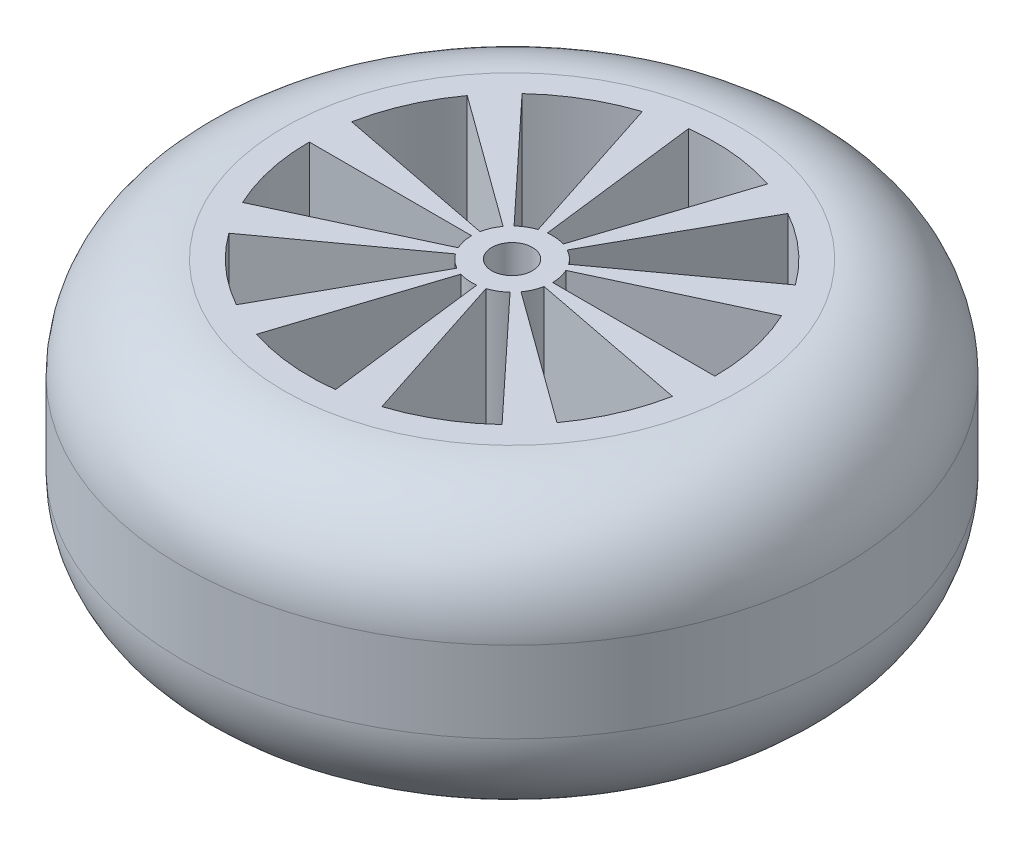
from build123d import *

# Parameters (mm, degrees)
SKETCH1_R           = 32.5
SKETCH1_R_2         = 2
BOSS_EXTRUDE1_DEPTH = 28
FILLET1_R           = 10
CUT_EXTRUDE2_DEPTH  = 28


with BuildPart() as part:
    # Sketch1 → Boss-Extrude1 (new body)
    with BuildSketch(Plane(origin=(0, 0, 0), x_dir=(1, 0, 0), z_dir=(0, 1, 0))):
        with Locations(Location((0, 0, 0), (0, 0, 270))):
            Circle(SKETCH1_R)
        with Locations(Location((0, 0, 0), (0, 0, 270))):
            Circle(SKETCH1_R_2, mode=Mode.SUBTRACT)
    extrude(amount=BOSS_EXTRUDE1_DEPTH)

    # Fillet1
    fillet1_edges = [part.edges().sort_by_distance(p)[0] for p in [
        (0, 0, -32.5),
        (0, 28, -32.5),
    ]]
    fillet(fillet1_edges, radius=FILLET1_R)

    # Sketch2 → Cut-Extrude2 (cut)
    with BuildSketch(Plane(origin=(0, 28, 0), x_dir=(1, 0, 0), z_dir=(0, 1, 0))):
        with BuildLine():
            ThreePointArc((-2.72799344, 2.925414806), (-2.030153452, 3.446516642), (-1.236067977, 3.804226065))
            Line((-1.236067977, 3.804226065), (-6.180339887, 19.021130326))
            ThreePointArc((-6.180339887, 19.021130326), (-10.150767259, 17.232583209), (-13.639967201, 14.627074032))
            Line((-13.639967201, 14.627074032), (-2.72799344, 2.925414806))
        make_face()
        with BuildLine():
            ThreePointArc((2.72799344, -2.925414806), (2.030153452, -3.446516642), (1.236067977, -3.804226065))
            Line((1.236067977, -3.804226065), (6.180339887, -19.021130326))
            ThreePointArc((6.180339887, -19.021130326), (10.150767259, -17.232583209), (13.639967201, -14.627074032))
            Line((13.639967201, -14.627074032), (2.72799344, -2.925414806))
        make_face()
        with BuildLine():
            ThreePointArc((0.487477374, -3.970184607), (-0.38338301, -3.981584793), (-1.236067977, -3.804226065))
            Line((-1.236067977, -3.804226065), (-6.180339887, -19.021130326))
            ThreePointArc((-6.180339887, -19.021130326), (-1.91691505, -19.907923967), (2.437386868, -19.850923033))
            Line((2.437386868, -19.850923033), (0.487477374, -3.970184607))
        make_face()
        with BuildLine():
            ThreePointArc((-0.487477374, 3.970184607), (0.38338301, 3.981584793), (1.236067977, 3.804226065))
            Line((1.236067977, 3.804226065), (6.180339887, 19.021130326))
            ThreePointArc((6.180339887, 19.021130326), (1.91691505, 19.907923967), (-2.437386868, 19.850923033))
            Line((-2.437386868, 19.850923033), (-0.487477374, 3.970184607))
        make_face()
        with BuildLine():
            ThreePointArc((1.939238481, 3.498478829), (2.650480193, 2.995822883), (3.236067977, 2.351141009))
            Line((3.236067977, 2.351141009), (16.180339887, 11.755705046))
            ThreePointArc((16.180339887, 11.755705046), (13.252400964, 14.979114416), (9.696192405, 17.492394143))
            Line((9.696192405, 17.492394143), (1.939238481, 3.498478829))
        make_face()
        with BuildLine():
            ThreePointArc((-1.939238481, -3.498478829), (-2.650480193, -2.995822883), (-3.236067977, -2.351141009))
            Line((-3.236067977, -2.351141009), (-16.180339887, -11.755705046))
            ThreePointArc((-16.180339887, -11.755705046), (-13.252400964, -14.979114416), (-9.696192405, -17.492394143))
            Line((-9.696192405, -17.492394143), (-1.939238481, -3.498478829))
        make_face()
        with BuildLine():
            ThreePointArc((3.625231148, 1.690473047), (3.905184028, 0.865758456), (4, 0))
            Line((4, 0), (20, 0))
            ThreePointArc((20, 0), (19.525920142, 4.328792279), (18.126155741, 8.452365235))
            Line((18.126155741, 8.452365235), (3.625231148, 1.690473047))
        make_face()
        with BuildLine():
            ThreePointArc((-3.625231148, -1.690473047), (-3.905184028, -0.865758456), (-4, 0))
            Line((-4, 0), (-20, 0))
            ThreePointArc((-20, 0), (-19.525920142, -4.328792279), (-18.126155741, -8.452365235))
            Line((-18.126155741, -8.452365235), (-3.625231148, -1.690473047))
        make_face()
        with BuildLine():
            Line((19.632543669, -3.816179908), (3.926508734, -0.763235982))
            ThreePointArc((3.926508734, -0.763235982), (3.668240298, -1.594996276), (3.236067977, -2.351141009))
            Line((3.236067977, -2.351141009), (16.180339887, -11.755705046))
            ThreePointArc((16.180339887, -11.755705046), (18.341201488, -7.974981379), (19.632543669, -3.816179908))
        make_face()
        with BuildLine():
            ThreePointArc((-3.926508734, 0.763235982), (-3.668240298, 1.594996276), (-3.236067977, 2.351141009))
            Line((-3.236067977, 2.351141009), (-16.180339887, 11.755705046))
            ThreePointArc((-16.180339887, 11.755705046), (-18.341201488, 7.974981379), (-19.632543669, 3.816179908))
            Line((-19.632543669, 3.816179908), (-3.926508734, 0.763235982))
        make_face()
    extrude(amount=-CUT_EXTRUDE2_DEPTH, mode=Mode.SUBTRACT)


solid = part.part
